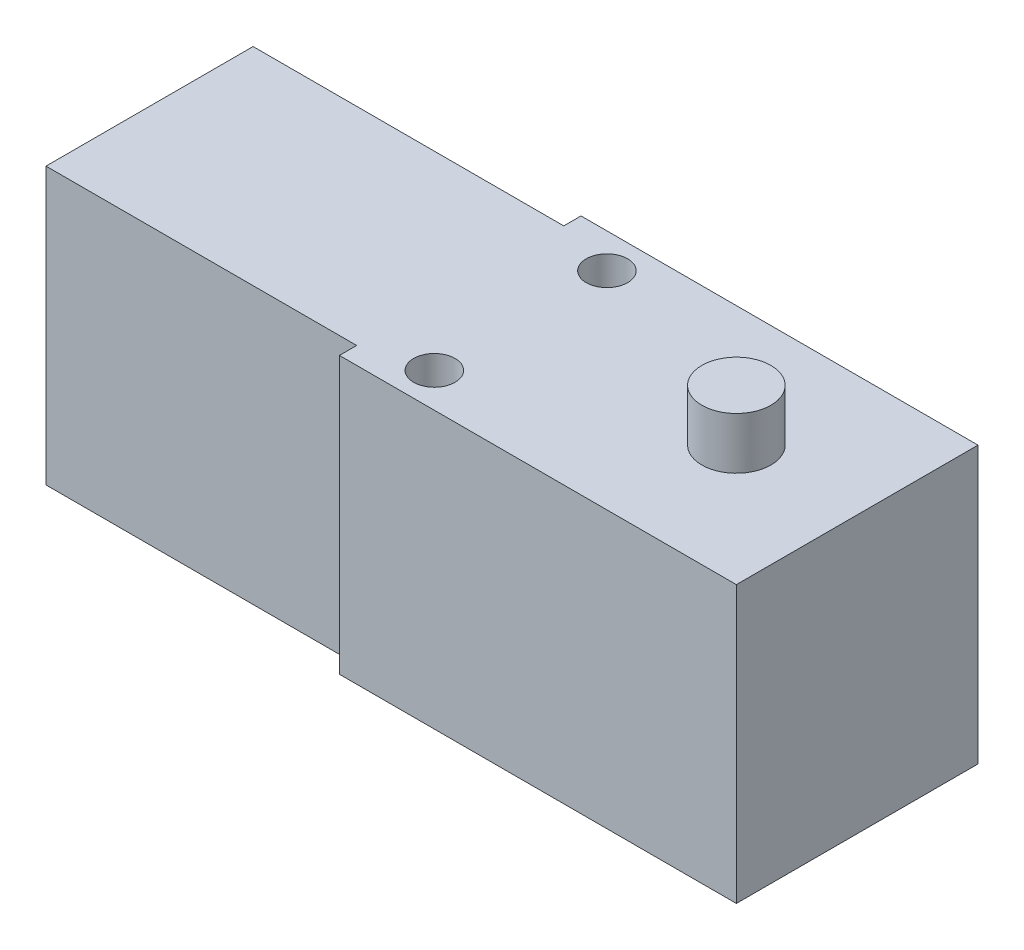
from build123d import *

# Parameters (mm, degrees)
SKETCH1_W           = 28.575
SKETCH1_H           = 19.05
BOSS_EXTRUDE1_DEPTH = 12.7
SKETCH2_R           = 3.175
BOSS_EXTRUDE2_DEPTH = 17.4625
SKETCH3_R           = 1.905
CUT_EXTRUDE1_DEPTH  = 49.645932191


with BuildPart() as part:
    # Sketch1 → Boss-Extrude1 (new, symmetric)
    with BuildSketch(Plane(origin=(0, 0, 0), x_dir=(1, 0, 0), z_dir=(0, 1, 0))):
        with Locations((-14.2875, 0)):
            Rectangle(SKETCH1_W, SKETCH1_H)
        Polygon((0, 9.525), (0, -9.525), (0, -11.1125), (36.5125, -11.1125), (36.5125, 11.1125), (0, 11.1125), align=None)
    extrude(amount=BOSS_EXTRUDE1_DEPTH, both=True)

    # Sketch2 → Boss-Extrude2 (add, symmetric)
    with BuildSketch(Plane.XZ):
        with Locations(Location((25.4, 0, 0), (0, 0, 90))):
            Circle(SKETCH2_R)
    extrude(amount=BOSS_EXTRUDE2_DEPTH, both=True)

    # Sketch3 → Cut-Extrude1 (cut, through all)
    with BuildSketch(Plane.XZ.offset(12.7)):
        with Locations(Location((5.55625, 7.9375, 0), (0, 0, 270))):
            Circle(SKETCH3_R)
        with Locations(Location((5.55625, -7.9375, 0), (0, 0, 270))):
            Circle(SKETCH3_R)
    extrude(amount=-CUT_EXTRUDE1_DEPTH, mode=Mode.SUBTRACT)


solid = part.part
